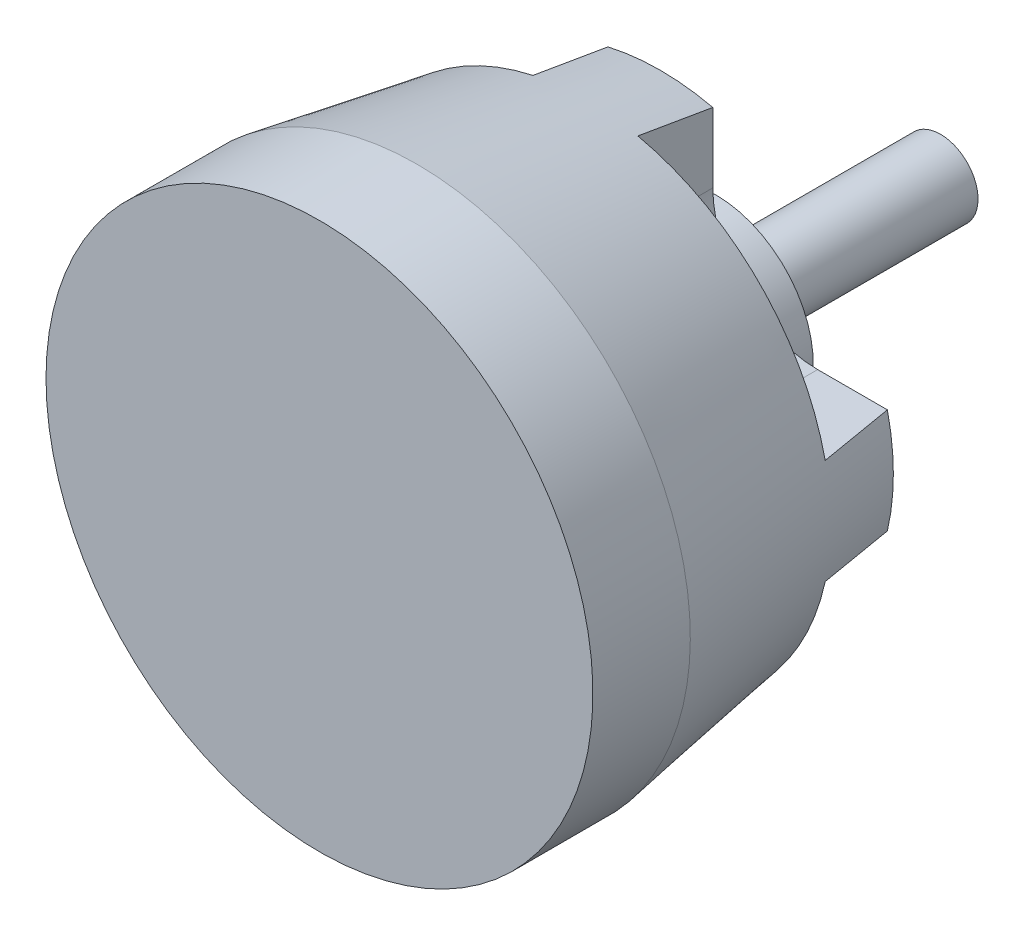
from build123d import *

# Parameters (mm, degrees)
SKETCH1_R           = 18.25
BOSS_EXTRUDE1_DEPTH = 6.5
SKETCH4_R           = 6.5
BOSS_EXTRUDE2_DEPTH = 3.7
SKETCH5_R           = 2.5
BOSS_EXTRUDE3_DEPTH = 15
CUT_EXTRUDE1_DEPTH  = 5
SKETCH7_R           = 1.5
CUT_EXTRUDE2_DEPTH  = 6


with BuildPart() as part:
    # Sketch1 → Boss-Extrude1 (new body)
    with BuildSketch(Plane.XY):
        with Locations(Location((0, 0, 0), (0, 0, 180))):
            Circle(SKETCH1_R)
    extrude(amount=BOSS_EXTRUDE1_DEPTH)

    # Sketch3 → Revolve1 (revolve)
    with BuildSketch(Plane(origin=(0, 0, 0), x_dir=(0, 0, -1), z_dir=(1, 0, 0)), mode=Mode.PRIVATE) as revolve1_sk:
        Polygon((0, 18.25), (16.25, 15.55), (16.25, 0), (0, 0), align=None)
    revolve(revolve1_sk.sketch.rotate(Axis((0, 0, -16.25), (0, 0, 1)), 90), axis=Axis((0, 0, -16.25), (0, 0, 1)))

    # Sketch4 → Boss-Extrude2 (add)
    with BuildSketch(Plane(origin=(0, 0, -16.25), x_dir=(-1, 0, 0), z_dir=(0, 0, -1))):
        with Locations(Location((0, 0, 0), (0, 0, 90))):
            Circle(SKETCH4_R)
    extrude(amount=BOSS_EXTRUDE2_DEPTH)

    # Sketch5 → Boss-Extrude3 (add)
    with BuildSketch(Plane(origin=(0, 0, -19.95), x_dir=(-1, 0, 0), z_dir=(0, 0, -1))):
        with Locations(Location((0, 0, 0), (0, 0, 90))):
            Circle(SKETCH5_R)
    extrude(amount=BOSS_EXTRUDE3_DEPTH)

    # Sketch6 → Cut-Extrude1 (cut)
    with BuildSketch(Plane(origin=(0, 0, -16.25), x_dir=(-1, 0, 0), z_dir=(0, 0, -1))):
        with BuildLine():
            Line((-3.5, 15.150990067), (-3.5, 10.5))
            ThreePointArc((-3.5, 10.5), (-5.550252532, 5.550252532), (-10.5, 3.5))
            Line((-10.5, 3.5), (-15.150990067, 3.5))
            Line((-15.150990067, 3.5), (-21.408705952, 3.5))
            Line((-21.408705952, 3.5), (-21.408705952, 22.256863772))
            Line((-21.408705952, 22.256863772), (-3.5, 22.256863772))
            Line((-3.5, 22.256863772), (-3.5, 15.150990067))
        make_face()
        with BuildLine():
            Line((3.5, 15.150990067), (3.5, 10.5))
            ThreePointArc((3.5, 10.5), (5.550252532, 5.550252532), (10.5, 3.5))
            Line((10.5, 3.5), (15.150990067, 3.5))
            Line((15.150990067, 3.5), (25.598095522, 3.5))
            Line((25.598095522, 3.5), (25.598095522, 22.256863772))
            Line((25.598095522, 22.256863772), (3.5, 22.256863772))
            Line((3.5, 22.256863772), (3.5, 15.150990067))
        make_face()
        with BuildLine():
            Line((15.150990067, -3.5), (10.5, -3.5))
            ThreePointArc((10.5, -3.5), (5.550252532, -5.550252532), (3.5, -10.5))
            Line((3.5, -10.5), (3.5, -15.150990067))
            Line((3.5, -15.150990067), (3.5, -21.507351745))
            Line((3.5, -21.507351745), (25.598095522, -21.507351745))
            Line((25.598095522, -21.507351745), (25.598095522, -3.5))
            Line((25.598095522, -3.5), (15.150990067, -3.5))
        make_face()
        with BuildLine():
            Line((-10.5, -3.5), (-15.150990067, -3.5))
            Line((-15.150990067, -3.5), (-25.919416914, -3.5))
            Line((-25.919416914, -3.5), (-25.919416914, -21.507351745))
            Line((-25.919416914, -21.507351745), (-3.5, -21.507351745))
            Line((-3.5, -21.507351745), (-3.5, -15.150990067))
            Line((-3.5, -15.150990067), (-3.5, -10.5))
            ThreePointArc((-3.5, -10.5), (-5.550252532, -5.550252532), (-10.5, -3.5))
        make_face()
    extrude(amount=-CUT_EXTRUDE1_DEPTH, mode=Mode.SUBTRACT)

    # Sketch7 → Cut-Extrude2 (cut)
    with BuildSketch(Plane(origin=(0, 0, -16.25), x_dir=(-1, 0, 0), z_dir=(0, 0, -1))):
        with Locations(Location((0, 12.5, 0), (0, 0, 90))):
            Circle(SKETCH7_R)
        with Locations(Location((12.5, 0, 0), (0, 0, 90))):
            Circle(SKETCH7_R)
        with Locations(Location((-12.5, 0, 0), (0, 0, 90))):
            Circle(SKETCH7_R)
        with Locations(Location((0, -12.5, 0), (0, 0, 90))):
            Circle(SKETCH7_R)
    extrude(amount=-CUT_EXTRUDE2_DEPTH, mode=Mode.SUBTRACT)


solid = part.part
